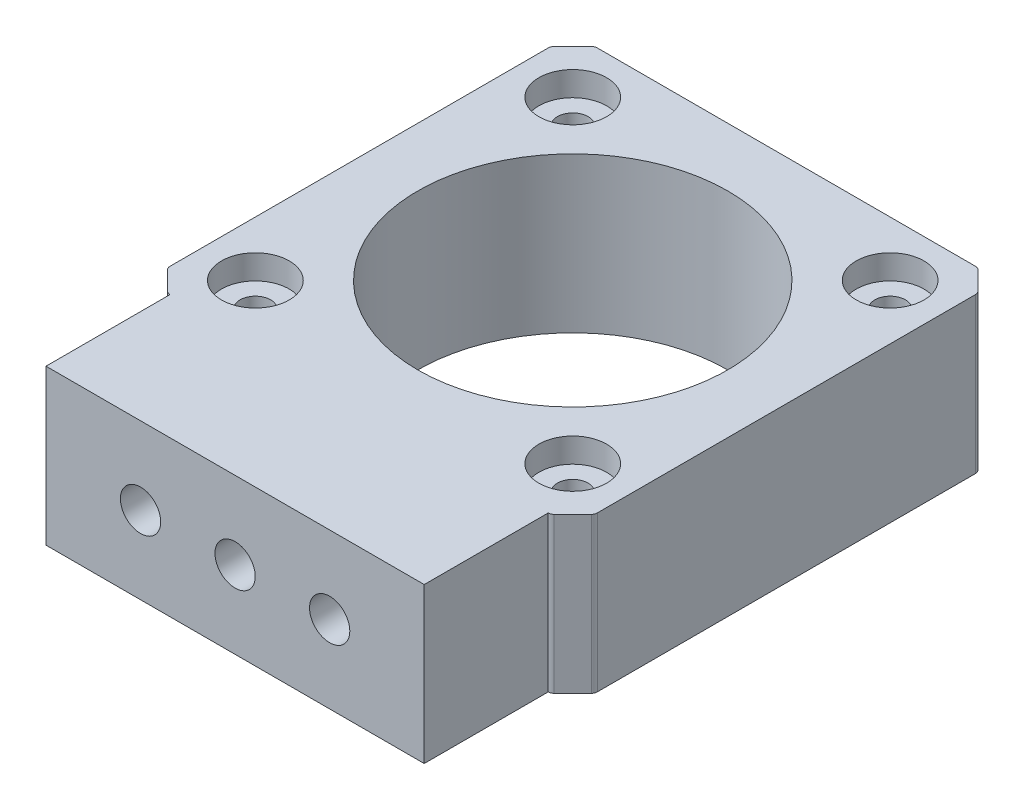
from build123d import *

# Parameters (mm, degrees)
SKETCH1_R           = 12.7
SKETCH1_R_2         = 1.65
BOSS_EXTRUDE1_DEPTH = 12.7
SKETCH2_R           = 1.65
CUT_EXTRUDE1_DEPTH  = 12.7
SKETCH3_R           = 2.77495
CUT_EXTRUDE3_DEPTH  = 1.99898
SKETCH7_R           = 1.65
BOSS_EXTRUDE2_DEPTH = 10.70102
SKETCH8_R           = 1.65
BOSS_EXTRUDE3_DEPTH = 10.70102
SKETCH9_R           = 1.65
BOSS_EXTRUDE4_DEPTH = 10.70102
SKETCH10_R          = 1.65
BOSS_EXTRUDE5_DEPTH = 10.70102
SKETCH12_R          = 1.25
CUT_EXTRUDE4_DEPTH  = 12.7
SKETCH11_R          = 1.25
CUT_EXTRUDE5_DEPTH  = 12.7
SKETCH17_W          = 30.98386677
SKETCH17_H          = 12.7
BOSS_EXTRUDE6_DEPTH = 10.16
SKETCH18_R          = 1.650000002
SKETCH18_R_2        = 1.65
CUT_EXTRUDE6_DEPTH  = 24.384


with BuildPart() as part:
    # Sketch1 → Boss-Extrude1 (new body)
    with BuildSketch(Plane(origin=(0, 0, 0), x_dir=(1, 0, 0), z_dir=(0, 1, 0))):
        with BuildLine():
            Line((21.686311219, 59.206008809), (23.227161891, 57.665158137))
            ThreePointArc((23.227161891, 57.665158137), (23.323849078, 57.508955756), (23.357596674, 57.328376976))
            Line((23.357596674, 57.328376976), (23.357596674, 26.344510207))
            ThreePointArc((23.357596674, 26.344510207), (23.323849078, 26.163931427), (23.227161891, 26.007729046))
            Line((23.227161891, 26.007729046), (21.686311219, 24.466878374))
            ThreePointArc((21.686311219, 24.466878374), (21.530108838, 24.370191187), (21.349530059, 24.336443591))
            Line((21.349530059, 24.336443591), (-9.634336711, 24.336443591))
            ThreePointArc((-9.634336711, 24.336443591), (-9.814915491, 24.370191187), (-9.971117871, 24.466878374))
            Line((-9.971117871, 24.466878374), (-11.511968543, 26.007729046))
            ThreePointArc((-11.511968543, 26.007729046), (-11.60865573, 26.163931427), (-11.642403326, 26.344510207))
            Line((-11.642403326, 26.344510207), (-11.642403326, 57.328376976))
            ThreePointArc((-11.642403326, 57.328376976), (-11.60865573, 57.508955756), (-11.511968543, 57.665158137))
            Line((-11.511968543, 57.665158137), (-9.971117871, 59.206008809))
            ThreePointArc((-9.971117871, 59.206008809), (-9.814915491, 59.302695995), (-9.634336711, 59.336443591))
            Line((-9.634336711, 59.336443591), (21.349530059, 59.336443591))
            ThreePointArc((21.349530059, 59.336443591), (21.530108838, 59.302695995), (21.686311219, 59.206008809))
        make_face()
        with Locations(Location((5.857596674, 41.836443591, 0), (0, 0, 90))):
            Circle(SKETCH1_R, mode=Mode.SUBTRACT)
        with Locations(Location((18.857596674, 54.836443591, 0), (0, 0, 90))):
            Circle(SKETCH1_R_2, mode=Mode.SUBTRACT)
        with Locations(Location((18.857596674, 28.836443591, 0), (0, 0, 90))):
            Circle(SKETCH1_R_2, mode=Mode.SUBTRACT)
        with Locations(Location((-7.142403326, 54.836443591, 0), (0, 0, 90))):
            Circle(SKETCH1_R_2, mode=Mode.SUBTRACT)
        with Locations(Location((-7.142403326, 28.836443591, 0), (0, 0, 90))):
            Circle(SKETCH1_R_2, mode=Mode.SUBTRACT)
    extrude(amount=BOSS_EXTRUDE1_DEPTH)

    # Sketch2 → Cut-Extrude1 (cut)
    with BuildSketch(Plane.XY.offset(-24.336443591)):
        with Locations((-1.888370018, 6.35)):
            Circle(SKETCH2_R)
        with Locations((13.603563366, 6.35)):
            Circle(SKETCH2_R)
        with Locations((5.857596674, 6.35)):
            Circle(SKETCH2_R)
    extrude(amount=-CUT_EXTRUDE1_DEPTH, mode=Mode.SUBTRACT)

    # Sketch3 → Cut-Extrude3 (cut)
    with BuildSketch(Plane(origin=(0, 12.7, 0), x_dir=(1, 0, 0), z_dir=(0, 1, 0))):
        with Locations(Location((-7.142403326, 54.836443591, 0), (0, 0, 270))):
            Circle(SKETCH3_R)
        with Locations(Location((18.857596674, 54.836443591, 0), (0, 0, 270))):
            Circle(SKETCH3_R)
        with Locations(Location((-7.142403326, 28.836443591, 0), (0, 0, 270))):
            Circle(SKETCH3_R)
        with Locations(Location((18.857596674, 28.836443591, 0), (0, 0, 270))):
            Circle(SKETCH3_R)
    extrude(amount=-CUT_EXTRUDE3_DEPTH, mode=Mode.SUBTRACT)

    # Sketch7 → Boss-Extrude2 (add, through all)
    with BuildSketch(Plane(origin=(0, 10.70102, 0), x_dir=(1, 0, 0), z_dir=(0, 1, 0))):
        with Locations((-7.142403326, 28.836443591)):
            Circle(SKETCH7_R)
    extrude(amount=-BOSS_EXTRUDE2_DEPTH)

    # Sketch8 → Boss-Extrude3 (add, through all)
    with BuildSketch(Plane(origin=(0, 10.70102, 0), x_dir=(1, 0, 0), z_dir=(0, 1, 0))):
        with Locations((-7.142403326, 54.836443591)):
            Circle(SKETCH8_R)
    extrude(amount=-BOSS_EXTRUDE3_DEPTH)

    # Sketch9 → Boss-Extrude4 (add, through all)
    with BuildSketch(Plane(origin=(0, 10.70102, 0), x_dir=(1, 0, 0), z_dir=(0, 1, 0))):
        with Locations((18.857596674, 54.836443591)):
            Circle(SKETCH9_R)
    extrude(amount=-BOSS_EXTRUDE4_DEPTH)

    # Sketch10 → Boss-Extrude5 (add, through all)
    with BuildSketch(Plane(origin=(0, 10.70102, 0), x_dir=(1, 0, 0), z_dir=(0, 1, 0))):
        with Locations((18.857596674, 28.836443591)):
            Circle(SKETCH10_R)
    extrude(amount=-BOSS_EXTRUDE5_DEPTH)

    # Sketch12 → Cut-Extrude4 (cut)
    with BuildSketch(Plane(origin=(0, 10.70102, 0), x_dir=(1, 0, 0), z_dir=(0, 1, 0))):
        with Locations(Location((18.857596674, 54.836443591, 0), (0, 0, 270))):
            Circle(SKETCH12_R)
        with Locations(Location((-7.142403326, 28.836443591, 0), (0, 0, 270))):
            Circle(SKETCH12_R)
        with Locations(Location((18.857596674, 28.836443591, 0), (0, 0, 270))):
            Circle(SKETCH12_R)
    extrude(amount=-CUT_EXTRUDE4_DEPTH, mode=Mode.SUBTRACT)

    # Sketch11 → Cut-Extrude5 (cut)
    with BuildSketch(Plane(origin=(0, 10.70102, 0), x_dir=(1, 0, 0), z_dir=(0, 1, 0))):
        with Locations(Location((-7.142403326, 54.836443591, 0), (0, 0, 270))):
            Circle(SKETCH11_R)
    extrude(amount=-CUT_EXTRUDE5_DEPTH, mode=Mode.SUBTRACT)

    # Sketch17 → Boss-Extrude6 (add)
    with BuildSketch(Plane.XY.offset(-24.336443591)):
        with Locations((5.857596674, 6.35)):
            Rectangle(SKETCH17_W, SKETCH17_H)
    extrude(amount=BOSS_EXTRUDE6_DEPTH)

    # Sketch18 → Cut-Extrude6 (cut)
    with BuildSketch(Plane.XY.offset(-14.176443591)):
        with Locations((-1.888370018, 6.35)):
            Circle(SKETCH18_R)
        with Locations((5.857596674, 6.35)):
            Circle(SKETCH18_R_2)
        with Locations((13.603563366, 6.35)):
            Circle(SKETCH18_R_2)
    extrude(amount=-CUT_EXTRUDE6_DEPTH, mode=Mode.SUBTRACT)


solid = part.part
